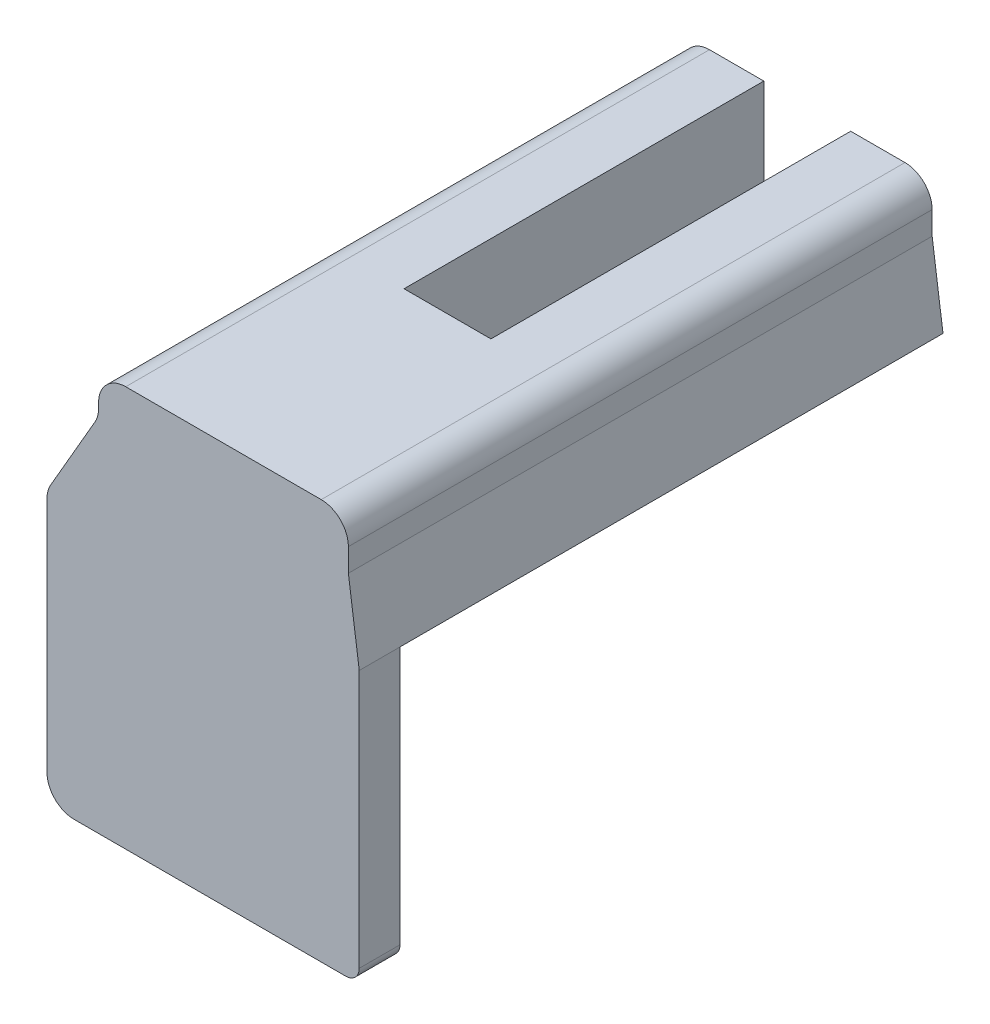
from build123d import *

# Parameters (mm, degrees)
SKETCH_1_W          = 20
SKETCH_1_H          = 20
EXTRUDE_1_DEPTH     = 3
SKETCH_2_W          = 7
SKETCH_2_H          = 6
EXTRUDE_2_DEPTH     = 40
SKETCH_3_W          = 3
SKETCH_3_H          = 20
EXTRUDE_3_DEPTH     = 25
CUT_EXTRUDE_1_REACH = 49.212
SKETCH_4_R          = 2.6
FILLET_1_R          = 1
SKETCH_5_W          = 3.2
SKETCH_5_H          = 3.9
CUT_EXTRUDE_2_DEPTH = 30
SKETCH_6_W          = 6
SKETCH_6_H          = 9.5
EXTRUDE_4_DEPTH     = 43
CHAMFER_1_SIZE      = 0.5
SKETCH_7_W          = 6.4
SKETCH_7_H          = 9.5
EXTRUDE_5_DEPTH     = 16.5
EXTRUDE_6_DEPTH     = 25
FILLET_2_R          = 2
SKETCH_10_W         = 1.9
SKETCH_10_H         = 2
CUT_EXTRUDE_3_DEPTH = 26.5
FILLET_3_R          = 0.5
FILLET_4_R          = 1
EXTRUDE_7_DEPTH     = 43


with BuildPart() as part:
    # ｽｹｯﾁ1 → ﾎﾞｽ - 押し出し1 (new body)
    with BuildSketch(Plane.XY):
        Rectangle(SKETCH_1_W, SKETCH_1_H)
    extrude(amount=EXTRUDE_1_DEPTH)

    # ｽｹｯﾁ2 → ﾎﾞｽ - 押し出し2 (add)
    with BuildSketch(Plane(origin=(0, 0, 0), x_dir=(-1, 0, 0), z_dir=(0, 0, -1))):
        with Locations((0, 7)):
            Rectangle(SKETCH_2_W, SKETCH_2_H)
    extrude(amount=EXTRUDE_2_DEPTH)

    # ｽｹｯﾁ3 → ﾎﾞｽ - 押し出し3 (add)
    with BuildSketch(Plane.XY.offset(3)):
        with Locations((-11.5, 0)):
            Rectangle(SKETCH_3_W, SKETCH_3_H)
    extrude(amount=-EXTRUDE_3_DEPTH)

    # ｽｹｯﾁ4 → ｶｯﾄ - 押し出し1 (cut, up to next)
    with BuildSketch(Plane(origin=(-13, 0, 0), x_dir=(0, 0, -1), z_dir=(1, 0, 0)), mode=Mode.PRIVATE) as cut_extrude_1_sk1:
        with Locations(Location((10, 0, 0), (0, 0, 90))):
            Circle(SKETCH_4_R)
    cut_extrude_1_tool1 = extrude(cut_extrude_1_sk1.sketch, amount=CUT_EXTRUDE_1_REACH, mode=Mode.PRIVATE) & part.part
    add(cut_extrude_1_tool1.solids().sort_by_distance((-13, 0, -10))[0], mode=Mode.SUBTRACT)

    # ﾌｨﾚｯﾄ1
    fillet_1_edges = [part.edges().sort_by_distance(p)[0] for p in [
        (10, -10, 1.5),
    ]]
    fillet(fillet_1_edges, radius=FILLET_1_R)

    # ｽｹｯﾁ5 → ｶｯﾄ - 押し出し2 (cut)
    with BuildSketch(Plane(origin=(0, 0, -13.5), x_dir=(-1, 0, 0), z_dir=(0, 0, -1))):
        with Locations((0, 8.05)):
            Rectangle(SKETCH_5_W, SKETCH_5_H)
    extrude(amount=CUT_EXTRUDE_2_DEPTH, mode=Mode.SUBTRACT)

    # ｽｹｯﾁ6 → ﾎﾞｽ - 押し出し4 (add)
    with BuildSketch(Plane.XY.offset(3)):
        with Locations((6.2, 14.75)):
            Rectangle(SKETCH_6_W, SKETCH_6_H)
        with Locations((-6.2, 14.75)):
            Rectangle(SKETCH_6_W, SKETCH_6_H)
    extrude(amount=-EXTRUDE_4_DEPTH)

    # 面取り1
    chamfer_1_edges = [part.edges().sort_by_distance(p)[0] for p in [
        (-3.5, 10, -20),
        (3.5, 10, -20),
    ]]
    chamfer(chamfer_1_edges, length=CHAMFER_1_SIZE)

    # ｽｹｯﾁ7 → ﾎﾞｽ - 押し出し5 (add)
    with BuildSketch(Plane.XY.offset(3)):
        with Locations((0, 14.75)):
            Rectangle(SKETCH_7_W, SKETCH_7_H)
    extrude(amount=-EXTRUDE_5_DEPTH)

    # ｽｹｯﾁ8 → ﾎﾞｽ - 押し出し6 (add)
    with BuildSketch(Plane.XY.offset(3)):
        Polygon((-13, 10), (-9.2, 10), (-9.2, 16.581793069), align=None)
    extrude(amount=-EXTRUDE_6_DEPTH)

    # ﾌｨﾚｯﾄ2
    fillet_2_edges = [part.edges().sort_by_distance(p)[0] for p in [
        (-9.2, 16.581793069, -9.5),
        (-13, -10, -9.5),
        (-13, 10, -9.5),
        (9.2, 19.5, -18.5),
        (-9.2, 19.5, -18.5),
    ]]
    fillet(fillet_2_edges, radius=FILLET_2_R)

    # ｽｹｯﾁ10 → ｶｯﾄ - 押し出し3 (cut)
    with BuildSketch(Plane(origin=(0, 0, -40), x_dir=(-1, 0, 0), z_dir=(0, 0, -1))):
        with Locations((2.55, 7.1)):
            Rectangle(SKETCH_10_W, SKETCH_10_H)
    extrude(amount=-CUT_EXTRUDE_3_DEPTH, mode=Mode.SUBTRACT)

    # ﾌｨﾚｯﾄ3
    fillet_3_edges = [part.edges().sort_by_distance(p)[0] for p in [
        (-3.5, 6.1, -26.75),
        (-3.5, 8.1, -26.75),
    ]]
    fillet(fillet_3_edges, radius=FILLET_3_R)

    # ﾌｨﾚｯﾄ4
    fillet_4_edges = [part.edges().sort_by_distance(p)[0] for p in [
        (-3.5, 4, -20),
        (3.5, 4, -20),
    ]]
    fillet(fillet_4_edges, radius=FILLET_4_R)

    # ｽｹｯﾁ9 → ﾎﾞｽ - 押し出し7 (add)
    with BuildSketch(Plane.XY.offset(3)):
        Polygon((10, 10), (9.2, 10), (9.2, 15.8), align=None)
    extrude(amount=-EXTRUDE_7_DEPTH)


solid = part.part
